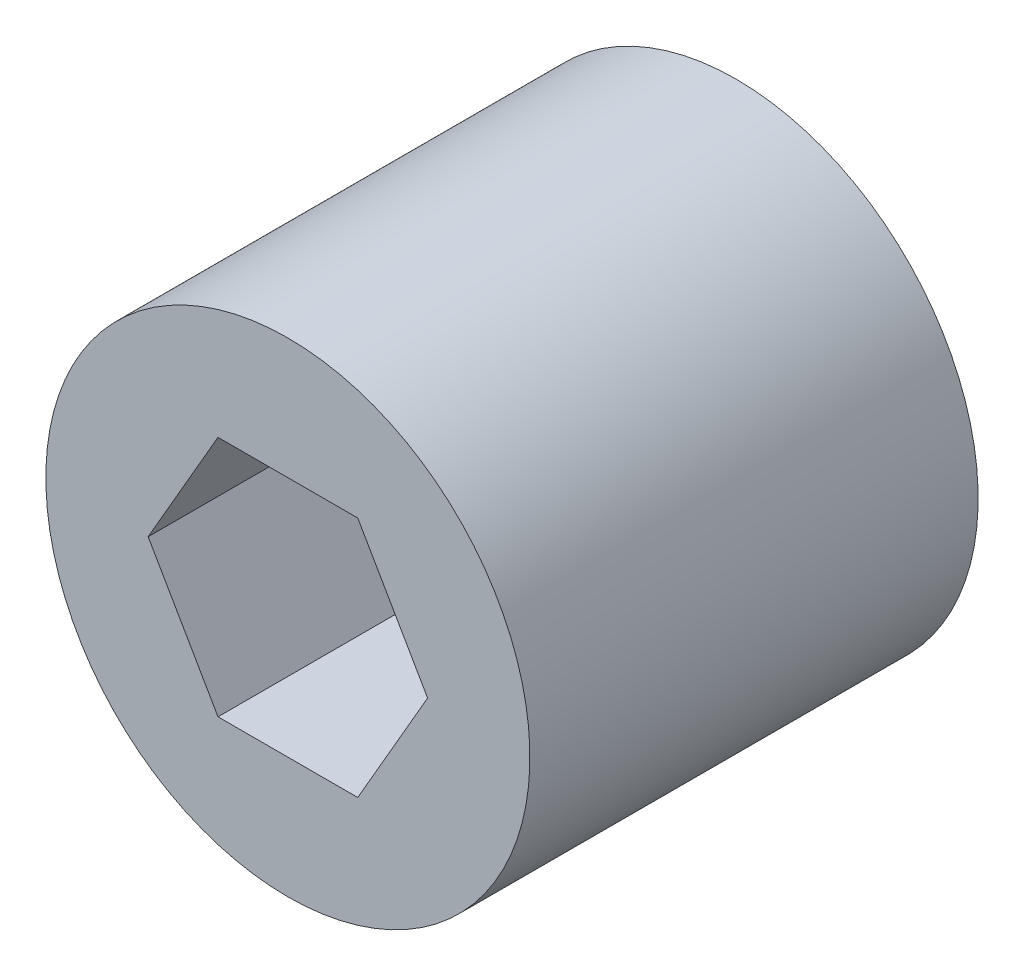
from build123d import *

# Parameters (mm, degrees)
CUT_EXTRUDE1_DEPTH = 30.593736097


with BuildPart() as part:
    # Sketch1 → Revolve1 (revolve)
    with BuildSketch(Plane(origin=(0, 0, 0), x_dir=(0, 0, -1), z_dir=(1, 0, 0)), mode=Mode.PRIVATE) as revolve1_sk:
        Polygon((0, 0), (23.5204, 0), (23.5204, 8.286019513), (23.5204, 12.7), (0, 12.7), (0, 8.286019513), align=None)
    revolve(revolve1_sk.sketch.rotate(Axis((0, 0, 0), (0, 0, -1)), 180), axis=Axis((0, 0, 0), (0, 0, -1)))

    # Sketch2 → Cut-Extrude1 (cut, through all)
    with BuildSketch(Plane.XY):
        Polygon((3.666174209, 6.35), (-3.666174209, 6.35), (-7.332348419, 0), (-3.666174209, -6.35), (3.666174209, -6.35), (7.332348419, 0), align=None)
    extrude(amount=-CUT_EXTRUDE1_DEPTH, mode=Mode.SUBTRACT)


solid = part.part
